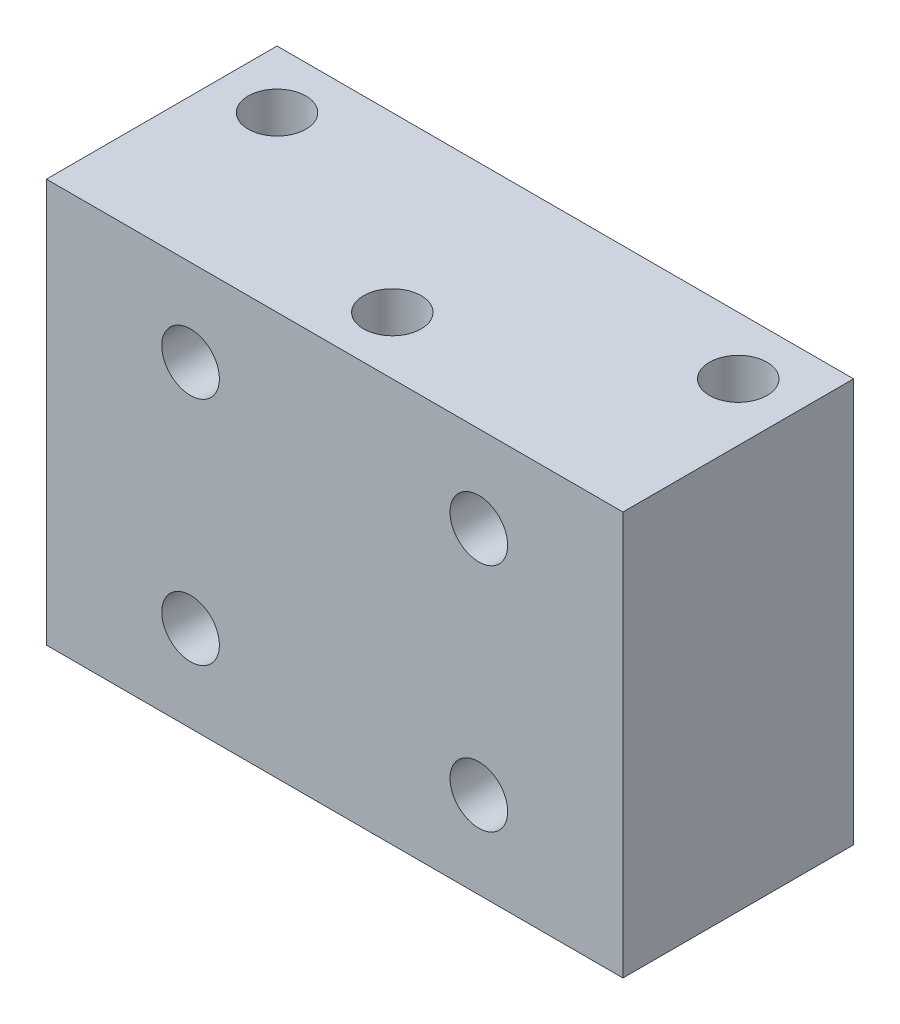
from build123d import *

# Parameters (mm, degrees)
SKETCH1_W           = 254
SKETCH1_H           = 177.8
BOSS_EXTRUDE1_DEPTH = 101.6
SKETCH4_R           = 12.7
CUT_EXTRUDE3_DEPTH  = 50.8
SKETCH6_R           = 12.7
CUT_EXTRUDE4_DEPTH  = 50.8
SKETCH7_R           = 12.7
CUT_EXTRUDE5_DEPTH  = 33.02


with BuildPart() as part:
    # Sketch1 → Boss-Extrude1 (new body)
    with BuildSketch(Plane.XY):
        Rectangle(SKETCH1_W, SKETCH1_H)
    extrude(amount=BOSS_EXTRUDE1_DEPTH)

    # Sketch4 → Cut-Extrude3 (cut)
    with BuildSketch(Plane.XZ.offset(88.9)):
        with Locations(Location((-101.6, 25.4, 0), (0, 0, 270))):
            Circle(SKETCH4_R)
        with Locations(Location((101.6, 25.4, 0), (0, 0, 270))):
            Circle(SKETCH4_R)
    cut_extrude3 = extrude(amount=-CUT_EXTRUDE3_DEPTH, mode=Mode.SUBTRACT)

    # Mirror4: Cut-Extrude3 across plane
    add(cut_extrude3.mirror(Plane.ZX), mode=Mode.SUBTRACT)

    # Sketch6 → Cut-Extrude4 (cut)
    with BuildSketch(Plane.XZ.offset(88.9)):
        with Locations(Location((0, 76.2, 0), (0, 0, 270))):
            Circle(SKETCH6_R)
    cut_extrude4 = extrude(amount=-CUT_EXTRUDE4_DEPTH, mode=Mode.SUBTRACT)

    # Mirror5: Cut-Extrude4 across plane
    add(cut_extrude4.mirror(Plane.ZX), mode=Mode.SUBTRACT)

    # Sketch7 → Cut-Extrude5 (cut)
    with BuildSketch(Plane.XY.offset(101.6)):
        with Locations((63.5, -50.8)):
            Circle(SKETCH7_R)
        with Locations((63.5, 50.8)):
            Circle(SKETCH7_R)
        with Locations((-63.5, -50.8)):
            Circle(SKETCH7_R)
        with Locations((-63.5, 50.8)):
            Circle(SKETCH7_R)
    extrude(amount=-CUT_EXTRUDE5_DEPTH, mode=Mode.SUBTRACT)


solid = part.part
